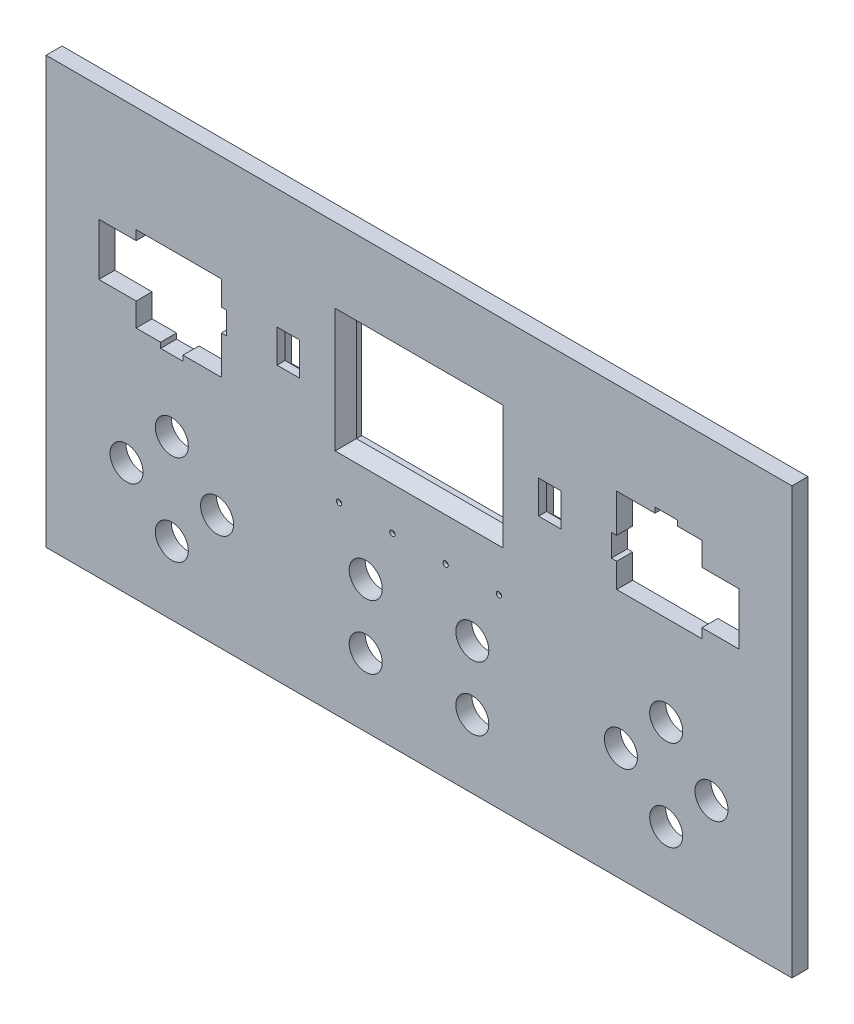
from build123d import *

# Parameters (mm, degrees)
SKETCH_1_W          = 140
SKETCH_1_H          = 80
EXTRUDE_1_DEPTH     = 3
SKETCH_2_W          = 27.5
SKETCH_2_H          = 19.2
CUT_EXTRUDE_1_DEPTH = 81.678373806
CHAMFER_1_SIZE      = 2
SKETCH_5_W          = 4.7
SKETCH_5_H          = 8.9
CUT_EXTRUDE_3_DEPTH = 81.678373806
SKETCH_5_4_W        = 4.7
SKETCH_5_4_H        = 8.9
SKETCH_5_4_W_2      = 4.2
SKETCH_5_4_H_2      = 6.2
EXTRUDE_2_DEPTH     = 1.5
SKETCH_7_R          = 3.1
CUT_EXTRUDE_5_DEPTH = 81.678373806
SKETCH_8_W          = 7
SKETCH_8_H          = 9.8
SKETCH_8_W_2        = 16
SKETCH_8_H_2        = 16
SKETCH_8_W_3        = 1
SKETCH_8_H_3        = 4.2
SKETCH_8_W_4        = 4.2
SKETCH_8_H_4        = 1
CUT_EXTRUDE_6_DEPTH = 81.678373806
SKETCH_9_R          = 0.35
CUT_EXTRUDE_7_DEPTH = 1.5


with BuildPart() as part:
    # 草图1 → 凸台-拉伸1 (new body)
    with BuildSketch(Plane.XY):
        Rectangle(SKETCH_1_W, SKETCH_1_H)
    extrude(amount=EXTRUDE_1_DEPTH)

    # 草图2 → 切除-拉伸1 (cut, through all)
    with BuildSketch(Plane.XY.offset(3)):
        with Locations((0, 14.4)):
            Rectangle(SKETCH_2_W, SKETCH_2_H)
    extrude(amount=-CUT_EXTRUDE_1_DEPTH, mode=Mode.SUBTRACT)

    # 倒角1
    chamfer_1_edges = [part.edges().sort_by_distance(p)[0] for p in [
        (13.75, 14.4, 3),
        (0, 24, 3),
        (0, 4.8, 3),
        (-13.75, 14.4, 3),
    ]]
    chamfer(chamfer_1_edges, length=CHAMFER_1_SIZE)

    # 草图3 → 切除-旋转4 (revolve, cut)
    with BuildSketch(Plane(origin=(0, -5.2, 0), x_dir=(1, 0, 0), z_dir=(0, 1, 0))):
        with BuildLine():
            Line((-15, -3), (-14.5, -3))
            Line((-14.5, -3), (-14.5, -2.419868415))
            ThreePointArc((-14.5, -2.419868415), (-13.70385186, -1.838083152), (-13.4, -0.9))
            Line((-13.4, -0.9), (-13.4, 0))
            Line((-13.4, 0), (-15, 0))
            Line((-15, 0), (-15, -3))
        make_face()
    revolve(axis=Axis((-15, -5.2, -6.01222587), (0, 0, 1)), mode=Mode.SUBTRACT)

    # 草图3<6> → 切除-旋转5 (revolve, cut)
    with BuildSketch(Plane(origin=(0, -5.2, 0), x_dir=(1, 0, 0), z_dir=(0, 1, 0))):
        with BuildLine():
            Line((-4.5, -3), (-4.5, -2.419868415))
            ThreePointArc((-4.5, -2.419868415), (-3.70385186, -1.838083152), (-3.4, -0.9))
            Line((-3.4, -0.9), (-3.4, 0))
            Line((-3.4, 0), (-5, 0))
            Line((-5, 0), (-5, -3))
            Line((-5, -3), (-4.5, -3))
        make_face()
    revolve(axis=Axis((-5, -5.2, -6.420763597), (0, 0, 1)), mode=Mode.SUBTRACT)

    # 草图3<7> → 切除-旋转6 (revolve, cut)
    with BuildSketch(Plane(origin=(0, -5.2, 0), x_dir=(1, 0, 0), z_dir=(0, 1, 0))):
        with BuildLine():
            Line((5.5, -3), (5.5, -2.419868415))
            ThreePointArc((5.5, -2.419868415), (6.29614814, -1.838083152), (6.6, -0.9))
            Line((6.6, -0.9), (6.6, 0))
            Line((6.6, 0), (5, 0))
            Line((5, 0), (5, -3))
            Line((5, -3), (5.5, -3))
        make_face()
    revolve(axis=Axis((5, -5.2, 10.056924733), (0, 0, -1)), mode=Mode.SUBTRACT)

    # 草图3<8> → 切除-旋转7 (revolve, cut)
    with BuildSketch(Plane(origin=(0, -5.2, 0), x_dir=(1, 0, 0), z_dir=(0, 1, 0))):
        with BuildLine():
            Line((15.5, -3), (15.5, -2.419868415))
            ThreePointArc((15.5, -2.419868415), (16.29614814, -1.838083152), (16.6, -0.9))
            Line((16.6, -0.9), (16.6, 0))
            Line((16.6, 0), (15, 0))
            Line((15, 0), (15, -3))
            Line((15, -3), (15.5, -3))
        make_face()
    revolve(axis=Axis((15, -5.2, 4.282924855), (0, 0, 1)), mode=Mode.SUBTRACT)

    # 草图5 → 切除-拉伸3 (cut, through all)
    with BuildSketch(Plane.XY.offset(3)):
        with Locations((-24.55, 14.4)):
            Rectangle(SKETCH_5_W, SKETCH_5_H)
        with Locations((24.55, 14.4)):
            Rectangle(SKETCH_5_W, SKETCH_5_H)
    extrude(amount=-CUT_EXTRUDE_3_DEPTH, mode=Mode.SUBTRACT)

    # 草图5<4> → 凸台-拉伸2 (add)
    # profile 1 of 2: a face of its own
    with BuildSketch(Plane.XY.offset(3)):
        with Locations((-24.55, 14.4)):
            Rectangle(SKETCH_5_4_W, SKETCH_5_4_H)
        with Locations((-24.55, 14.4)):
            Rectangle(SKETCH_5_4_W_2, SKETCH_5_4_H_2, mode=Mode.SUBTRACT)
    # profile 2 of 2: a face of its own
    with BuildSketch(Plane.XY.offset(3)):
        with Locations((24.55, 14.4)):
            Rectangle(SKETCH_5_4_W, SKETCH_5_4_H)
        with Locations((24.55, 14.4)):
            Rectangle(SKETCH_5_4_W_2, SKETCH_5_4_H_2, mode=Mode.SUBTRACT)
    extrude(amount=-EXTRUDE_2_DEPTH)

    # 草图7 → 切除-拉伸5 (cut, through all)
    with BuildSketch(Plane.XY.offset(3)):
        with Locations((-46.4, -10.2)):
            Circle(SKETCH_7_R)
        with Locations((-46.4, -27.2)):
            Circle(SKETCH_7_R)
        with Locations((-54.9, -18.7)):
            Circle(SKETCH_7_R)
        with Locations((-37.9, -18.7)):
            Circle(SKETCH_7_R)
        with Locations((-10, -15.2)):
            Circle(SKETCH_7_R)
        with Locations((10, -15.2)):
            Circle(SKETCH_7_R)
        with Locations((-10, -27.2)):
            Circle(SKETCH_7_R)
        with Locations((10, -27.2)):
            Circle(SKETCH_7_R)
        with Locations((46.4, -10.2)):
            Circle(SKETCH_7_R)
        with Locations((37.9, -18.7)):
            Circle(SKETCH_7_R)
        with Locations((54.9, -18.7)):
            Circle(SKETCH_7_R)
        with Locations((46.4, -27.2)):
            Circle(SKETCH_7_R)
    extrude(amount=-CUT_EXTRUDE_5_DEPTH, mode=Mode.SUBTRACT)

    # 草图8 → 切除-拉伸6 (cut, through all)
    with BuildSketch(Plane.XY.offset(3)):
        with Locations((-56.6, 13.4)):
            Rectangle(SKETCH_8_W, SKETCH_8_H)
        with Locations((-45.1, 12.1)):
            Rectangle(SKETCH_8_W_2, SKETCH_8_H_2)
        with Locations((-36.6, 13.4)):
            Rectangle(SKETCH_8_W_3, SKETCH_8_H_3)
        with Locations((-46.4, 3.6)):
            Rectangle(SKETCH_8_W_4, SKETCH_8_H_4)
        with Locations((45.1, 14.7)):
            Rectangle(SKETCH_8_W_2, SKETCH_8_H_2)
        with Locations((56.6, 13.4)):
            Rectangle(SKETCH_8_W, SKETCH_8_H)
        with Locations((36.6, 13.4)):
            Rectangle(SKETCH_8_W_3, SKETCH_8_H_3)
        with Locations((46.4, 23.2)):
            Rectangle(SKETCH_8_W_4, SKETCH_8_H_4)
    extrude(amount=-CUT_EXTRUDE_6_DEPTH, mode=Mode.SUBTRACT)

    # 草图9 → 切除-拉伸7 (cut)
    with BuildSketch(Plane(origin=(0, 0, 0), x_dir=(-1, 0, 0), z_dir=(0, 0, -1))):
        with Locations((-61.65, 21.2)):
            Circle(SKETCH_9_R)
        with Locations((-61.65, 5.6)):
            Circle(SKETCH_9_R)
        with Locations((-35.55, 21.2)):
            Circle(SKETCH_9_R)
        with Locations((-35.55, 5.6)):
            Circle(SKETCH_9_R)
        with Locations((-24.55, 22.4)):
            Circle(SKETCH_9_R)
        with Locations((-24.55, 6.4)):
            Circle(SKETCH_9_R)
        with Locations((-17.35, 26.65)):
            Circle(SKETCH_9_R)
        with Locations((-17.35, 2.15)):
            Circle(SKETCH_9_R)
        with Locations((17.35, 26.65)):
            Circle(SKETCH_9_R)
        with Locations((17.35, 2.15)):
            Circle(SKETCH_9_R)
        with Locations((24.55, 22.4)):
            Circle(SKETCH_9_R)
        with Locations((24.55, 6.4)):
            Circle(SKETCH_9_R)
        with Locations((35.55, 21.2)):
            Circle(SKETCH_9_R)
        with Locations((35.55, 5.6)):
            Circle(SKETCH_9_R)
        with Locations((61.65, 21.2)):
            Circle(SKETCH_9_R)
        with Locations((61.65, 5.6)):
            Circle(SKETCH_9_R)
        with Locations((46.4, -2.1)):
            Circle(SKETCH_9_R)
        with Locations((29.8, -18.7)):
            Circle(SKETCH_9_R)
        with Locations((46.4, -35.3)):
            Circle(SKETCH_9_R)
        with Locations((63, -18.7)):
            Circle(SKETCH_9_R)
        with Locations((-21.225, -5.2)):
            Circle(SKETCH_9_R)
        with Locations((0, -1.2)):
            Circle(SKETCH_9_R)
        with Locations((0, -9.2)):
            Circle(SKETCH_9_R)
        with Locations((21.225, -5.2)):
            Circle(SKETCH_9_R)
        with Locations((-18.1, -15.2)):
            Circle(SKETCH_9_R)
        with Locations((-18.1, -27.2)):
            Circle(SKETCH_9_R)
        with Locations((-3.5, -21.2)):
            Circle(SKETCH_9_R)
        with Locations((3.5, -21.2)):
            Circle(SKETCH_9_R)
        with Locations((18.1, -15.2)):
            Circle(SKETCH_9_R)
        with Locations((18.1, -27.2)):
            Circle(SKETCH_9_R)
        with Locations((-46.4, -2.1)):
            Circle(SKETCH_9_R)
        with Locations((-29.8, -18.7)):
            Circle(SKETCH_9_R)
        with Locations((-46.4, -35.3)):
            Circle(SKETCH_9_R)
        with Locations((-63, -18.7)):
            Circle(SKETCH_9_R)
    extrude(amount=-CUT_EXTRUDE_7_DEPTH, mode=Mode.SUBTRACT)


solid = part.part
